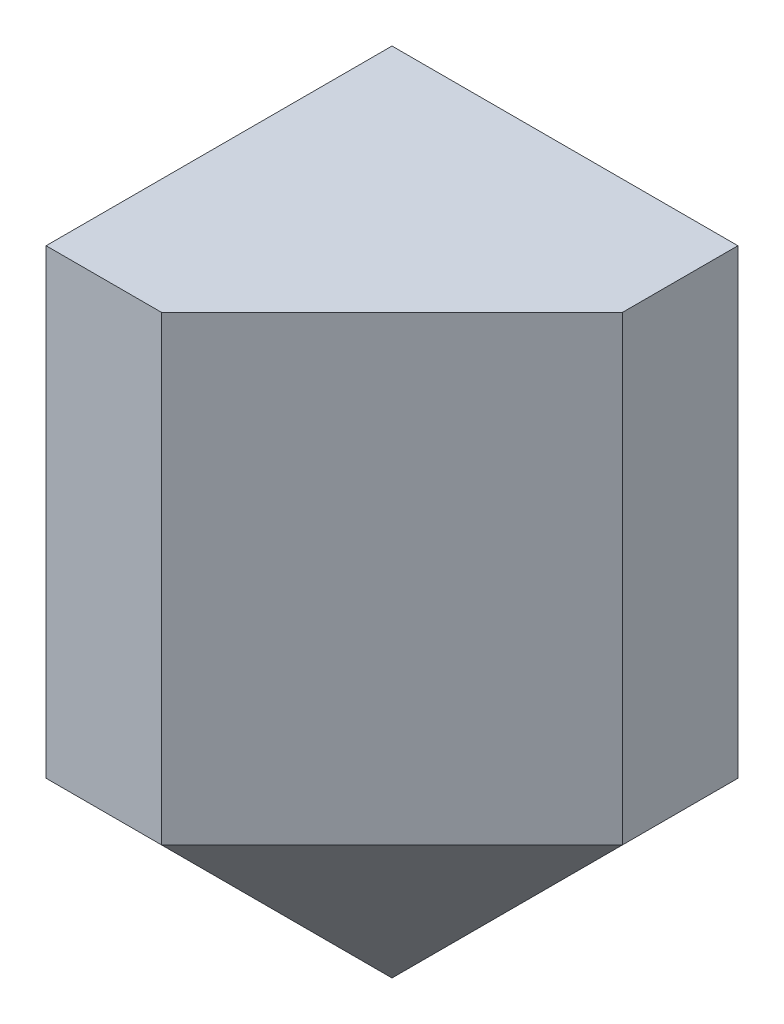
from build123d import *

# Parameters (mm, degrees)
SCHIZZO1_W                   = 30
SCHIZZO1_H                   = 40
ESTRUSIONE_ESTRUSIONE1_DEPTH = 30
SMUSSO1_SIZE                 = 20
ESTRUSIONE_ESTRUSIONE2_DEPTH = 20
FORO_PER_VITE_M5_1_D         = 5.5
FORO_PER_VITE_M5_1_DEPTH     = 15
FORO_PER_VITE_M5_1_TIP       = 1.652366702
FORO_PER_VITE_M5_2_D         = 5.5
FORO_PER_VITE_M5_2_DEPTH     = 15
FORO_PER_VITE_M5_2_TIP       = 1.652366702


with BuildPart() as part:
    # Schizzo1 → Estrusione-Estrusione1 (new body)
    with BuildSketch(Plane.XY):
        with Locations((15, 20)):
            Rectangle(SCHIZZO1_W, SCHIZZO1_H)
    extrude(amount=ESTRUSIONE_ESTRUSIONE1_DEPTH)

    # Smusso1
    smusso1_edges = [part.edges().sort_by_distance(p)[0] for p in [
        (30, 20, 30),
        (30, 0, 15),
        (15, 0, 30),
    ]]
    chamfer(smusso1_edges, length=SMUSSO1_SIZE)

    # Schizzo2 → Estrusione-Estrusione2 (add)
    with BuildSketch(Plane(origin=(0, 40, 0), x_dir=(1, 0, 0), z_dir=(0, 1, 0))):
        Polygon((0, 0), (30, 0), (30, -10), (10, -30), (0, -30), align=None)
    extrude(amount=ESTRUSIONE_ESTRUSIONE2_DEPTH)

    # Foro per Vite M5-1
    with Locations(Plane.ZY):
        with Locations((18, 20), (18, 48)):
            Hole(FORO_PER_VITE_M5_1_D / 2, depth=FORO_PER_VITE_M5_1_DEPTH)
            with Locations((0, 0, -(FORO_PER_VITE_M5_1_DEPTH + FORO_PER_VITE_M5_1_TIP / 2))):  # 118° drill point
                Cone(0, FORO_PER_VITE_M5_1_D / 2, FORO_PER_VITE_M5_1_TIP, mode=Mode.SUBTRACT)

    # Foro per Vite M5-2
    with Locations(Plane(origin=(18, 20, 0), x_dir=(-1, 0, 0), z_dir=(0, 0, -1))):
        with Locations((0, 0), (0, 28)):
            Hole(FORO_PER_VITE_M5_2_D / 2, depth=FORO_PER_VITE_M5_2_DEPTH)
            with Locations((0, 0, -(FORO_PER_VITE_M5_2_DEPTH + FORO_PER_VITE_M5_2_TIP / 2))):  # 118° drill point
                Cone(0, FORO_PER_VITE_M5_2_D / 2, FORO_PER_VITE_M5_2_TIP, mode=Mode.SUBTRACT)


solid = part.part
